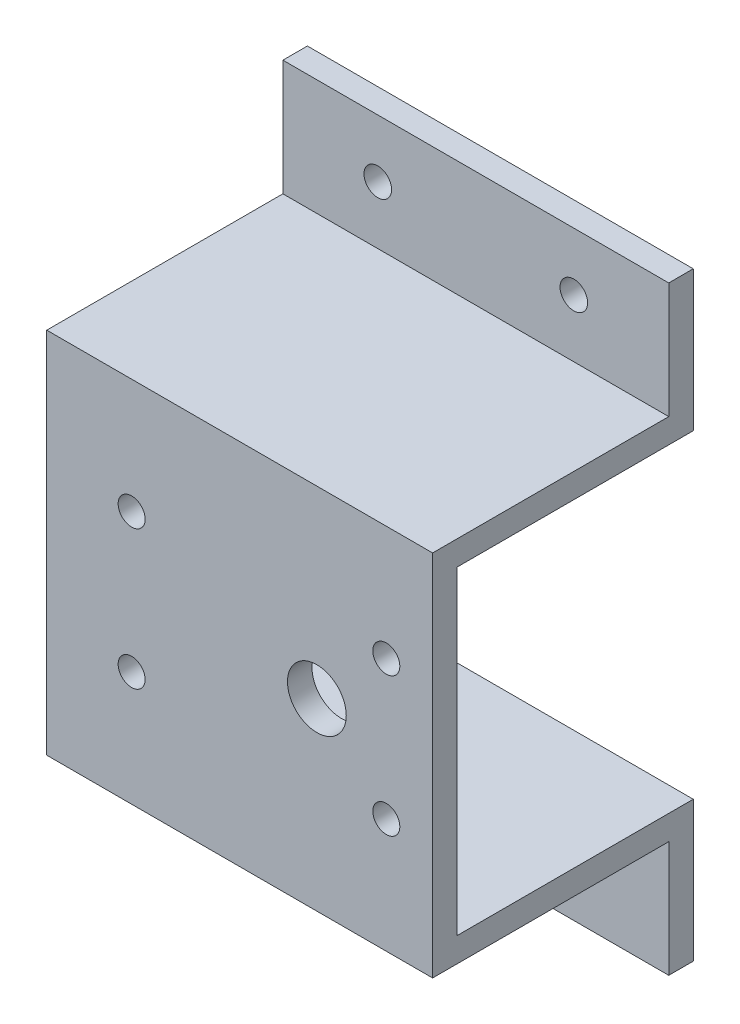
from build123d import *

# Parameters (mm, degrees)
SKETCH1_W           = 50
SKETCH1_H           = 47.7
SKETCH1_R           = 1.75
SKETCH1_R_2         = 3.81
BOSS_EXTRUDE1_DEPTH = 3.175
SKETCH2_W           = 50
SKETCH2_H           = 3.175
BOSS_EXTRUDE2_DEPTH = 30.5976
SKETCH3_W           = 50
SKETCH3_H           = 3.175
BOSS_EXTRUDE3_DEPTH = 15
CUT_EXTRUDE1_REACH  = 62.585
SKETCH4_R           = 1.7859375


with BuildPart() as part:
    # Sketch1 → Boss-Extrude1 (new body)
    with BuildSketch(Plane.XY):
        with Locations((-10, 0)):
            Rectangle(SKETCH1_W, SKETCH1_H)
        with Locations((-24, 9)):
            Circle(SKETCH1_R, mode=Mode.SUBTRACT)
        with Locations((-24, -9)):
            Circle(SKETCH1_R, mode=Mode.SUBTRACT)
        with Locations((9, -9)):
            Circle(SKETCH1_R, mode=Mode.SUBTRACT)
        with Locations((9, 9)):
            Circle(SKETCH1_R, mode=Mode.SUBTRACT)
        Circle(SKETCH1_R_2, mode=Mode.SUBTRACT)
    extrude(amount=BOSS_EXTRUDE1_DEPTH)

    # Sketch2 → Boss-Extrude2 (add)
    with BuildSketch(Plane(origin=(0, 0, 0), x_dir=(-1, 0, 0), z_dir=(0, 0, -1))):
        with Locations((10, -22.2625)):
            Rectangle(SKETCH2_W, SKETCH2_H)
        with Locations((10, 22.2625)):
            Rectangle(SKETCH2_W, SKETCH2_H)
    extrude(amount=BOSS_EXTRUDE2_DEPTH)

    # Sketch3 → Boss-Extrude3 (add)
    with BuildSketch(Plane(origin=(0, 23.85, 0), x_dir=(1, 0, 0), z_dir=(0, 1, 0))):
        with Locations((-10, 29.0101)):
            Rectangle(SKETCH3_W, SKETCH3_H)
    boss_extrude3 = extrude(amount=BOSS_EXTRUDE3_DEPTH)

    # Sketch4 → Cut-Extrude1 (cut, up to next)
    with BuildSketch(Plane.XY.offset(-27.4226), mode=Mode.PRIVATE) as cut_extrude1_sk1:
        with Locations((2.7, 31.35)):
            Circle(SKETCH4_R)
    cut_extrude1_tool1 = extrude(cut_extrude1_sk1.sketch, amount=-CUT_EXTRUDE1_REACH, mode=Mode.PRIVATE) & part.part
    # Sketch4 → Cut-Extrude1 (cut, up to next)
    with BuildSketch(Plane.XY.offset(-27.4226), mode=Mode.PRIVATE) as cut_extrude1_sk2:
        with Locations((-22.7, 31.35)):
            Circle(SKETCH4_R)
    cut_extrude1_tool2 = extrude(cut_extrude1_sk2.sketch, amount=-CUT_EXTRUDE1_REACH, mode=Mode.PRIVATE) & part.part
    cut_extrude1_1 = cut_extrude1_tool1.solids().sort_by_distance((2.7, 31.35, -27.4226))[0]
    add(cut_extrude1_1, mode=Mode.SUBTRACT)
    cut_extrude1_2 = cut_extrude1_tool2.solids().sort_by_distance((-22.7, 31.35, -27.4226))[0]
    add(cut_extrude1_2, mode=Mode.SUBTRACT)
    cut_extrude1 = cut_extrude1_1 + cut_extrude1_2  # Cut-Extrude1 as one shape, for the pattern or mirror that repeats it

    # Mirror1: Boss-Extrude3, Cut-Extrude1 across plane
    add(boss_extrude3.mirror(Plane.ZX))
    add(cut_extrude1.mirror(Plane.ZX), mode=Mode.SUBTRACT)


solid = part.part
